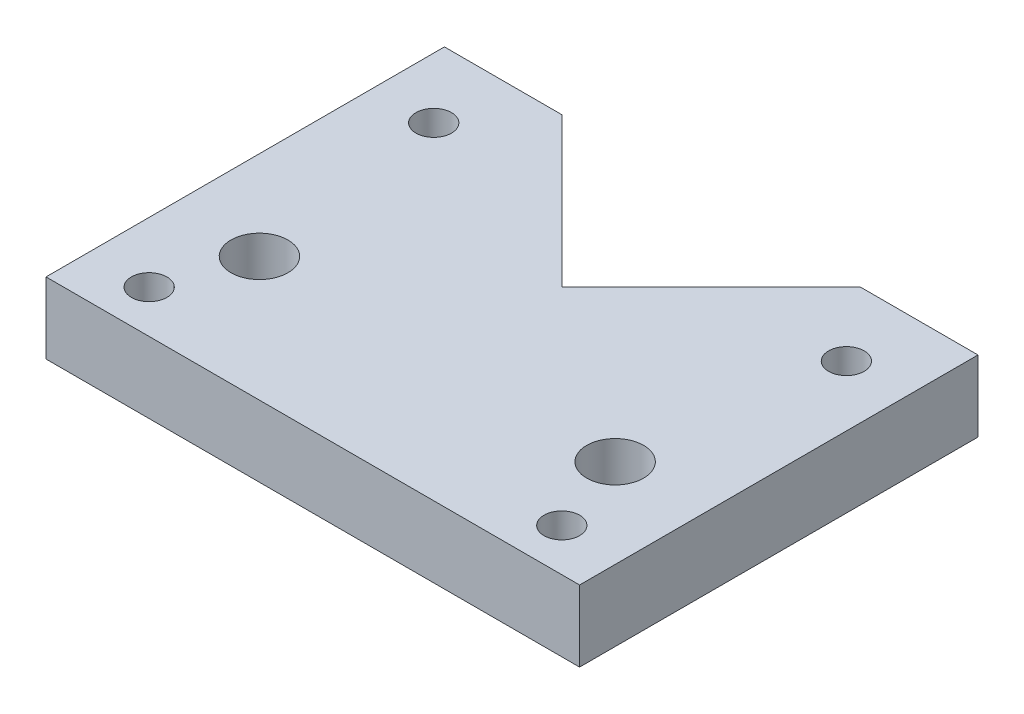
from build123d import *

# Parameters (mm, degrees)
SKETCH1_W               = 75
SKETCH1_H               = 10
BOSS_EXTRUDE1_DEPTH     = 35
CUT_EXTRUDE1_DEPTH      = 53.261362401
CUT_EXTRUDE1_DEPTH_BACK = 53.261362401
SKETCH2_R               = 4
CUT_EXTRUDE2_DEPTH      = 53.261362401
CUT_EXTRUDE2_DEPTH_BACK = 53.261362401
SKETCH3_R               = 2.5
SKETCH4_W               = 75
SKETCH4_H               = 10
BOSS_EXTRUDE2_DEPTH     = 21
CUT_EXTRUDE3_DEPTH      = 53.261362401
CUT_EXTRUDE3_DEPTH_BACK = 53.261362401
SKETCH5_R               = 2.5
CUT_EXTRUDE4_DEPTH      = 4
CUT_EXTRUDE5_DEPTH      = 53.261362401
CUT_EXTRUDE5_DEPTH_BACK = 53.261362401


with BuildPart() as part:
    # Sketch1 → Boss-Extrude1 (new body)
    with BuildSketch(Plane.XY):
        with Locations((0, -5)):
            Rectangle(SKETCH1_W, SKETCH1_H)
    extrude(amount=BOSS_EXTRUDE1_DEPTH)

    # Sketch2 → Cut-Extrude1 (cut, two sides: drawn at the far end of the back side and taken through both)
    with BuildSketch(Plane(origin=(0, 0, 0), x_dir=(1, 0, 0), z_dir=(0, 1, 0)).offset(-CUT_EXTRUDE1_DEPTH_BACK)):
        with Locations(Location((-25, -17.5, 0), (0, 0, 180))):
            Circle(SKETCH2_R)
        with Locations(Location((25, -17.5, 0), (0, 0, 180))):
            Circle(SKETCH2_R)
    extrude(amount=CUT_EXTRUDE1_DEPTH + CUT_EXTRUDE1_DEPTH_BACK, mode=Mode.SUBTRACT)

    # Sketch3 → Cut-Extrude2 (cut, two sides: drawn at the far end of the back side and taken through both)
    with BuildSketch(Plane(origin=(0, 0, 0), x_dir=(1, 0, 0), z_dir=(0, 1, 0)).offset(-CUT_EXTRUDE2_DEPTH_BACK)):
        with Locations(Location((-29, -29, 0), (0, 0, 180))):
            Circle(SKETCH3_R)
        with Locations((29, -29)):
            Circle(SKETCH3_R)
    extrude(amount=CUT_EXTRUDE2_DEPTH + CUT_EXTRUDE2_DEPTH_BACK, mode=Mode.SUBTRACT)

    # Sketch4 → Boss-Extrude2 (add)
    with BuildSketch(Plane(origin=(0, 0, 0), x_dir=(-1, 0, 0), z_dir=(0, 0, -1))):
        with Locations((0, -5)):
            Rectangle(SKETCH4_W, SKETCH4_H)
    extrude(amount=BOSS_EXTRUDE2_DEPTH)

    # Sketch5 → Cut-Extrude3 (cut, two sides: drawn at the far end of the back side and taken through both)
    with BuildSketch(Plane(origin=(0, 0, 0), x_dir=(1, 0, 0), z_dir=(0, 1, 0)).offset(-CUT_EXTRUDE3_DEPTH_BACK)):
        with Locations(Location((-29, 11, 0), (0, 0, 180))):
            Circle(SKETCH5_R)
        with Locations((29, 11)):
            Circle(SKETCH5_R)
    extrude(amount=CUT_EXTRUDE3_DEPTH + CUT_EXTRUDE3_DEPTH_BACK, mode=Mode.SUBTRACT)

    # Sketch6 → Cut-Extrude4 (cut)
    with BuildSketch(Plane.XZ.offset(10)):
        Polygon((-24.381197846, 29), (-26.690598923, 33), (-31.309401077, 33), (-33.618802154, 29), (-31.309401077, 25), (-26.690598923, 25), align=None)
        Polygon((33.618802154, 29), (31.309401077, 33), (26.690598923, 33), (24.381197846, 29), (26.690598923, 25), (31.309401077, 25), align=None)
        Polygon((-24.381197846, -11), (-26.690598923, -7), (-31.309401077, -7), (-33.618802154, -11), (-31.309401077, -15), (-26.690598923, -15), align=None)
        Polygon((33.618802154, -11), (31.309401077, -7), (26.690598923, -7), (24.381197846, -11), (26.690598923, -15), (31.309401077, -15), align=None)
    extrude(amount=-CUT_EXTRUDE4_DEPTH, mode=Mode.SUBTRACT)

    # Sketch7 → Cut-Extrude5 (cut, two sides: drawn at the far end of the back side and taken through both)
    with BuildSketch(Plane(origin=(0, 0, 0), x_dir=(1, 0, 0), z_dir=(0, 1, 0)).offset(-CUT_EXTRUDE5_DEPTH_BACK)):
        Polygon((0, 0), (21, 21), (-21, 21), align=None)
    extrude(amount=CUT_EXTRUDE5_DEPTH + CUT_EXTRUDE5_DEPTH_BACK, mode=Mode.SUBTRACT)


solid = part.part
